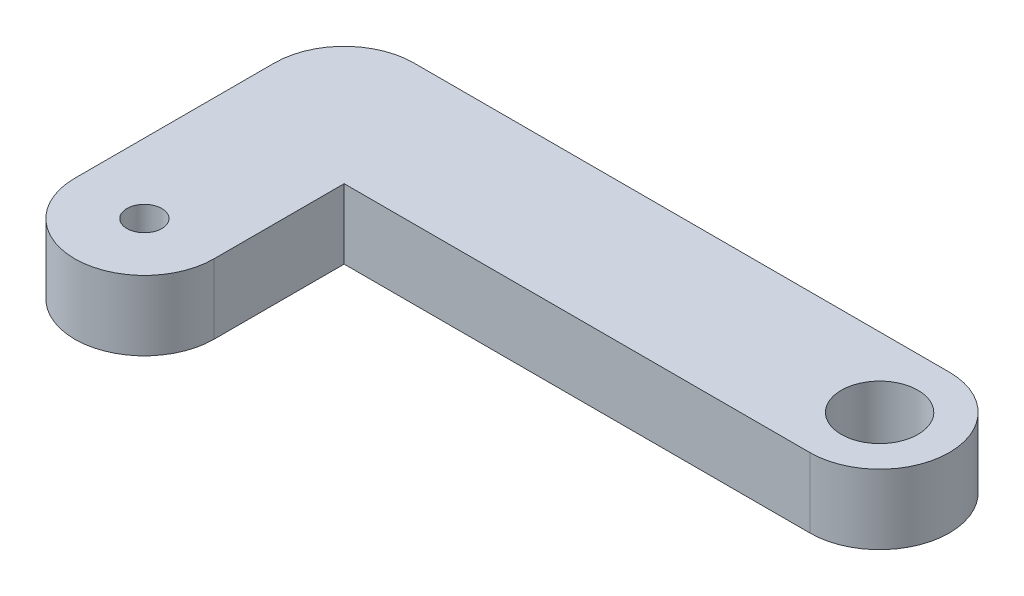
from build123d import *

# Parameters (mm, degrees)
SKETCH_1_R          = 1.65
EXTRUDE_1_DEPTH     = 3
EXTRUDE_2_DEPTH     = 3
CUT_EXTRUDE_1_REACH = 30.673
SKETCH_3_R          = 0.75


with BuildPart() as part:
    # 草图1 → 凸台-拉伸1 (new body)
    with BuildSketch(Plane(origin=(0, 0, 0), x_dir=(1, 0, 0), z_dir=(0, 1, 0))):
        with BuildLine():
            Line((0, 3), (23.05, 3))
            ThreePointArc((23.05, 3), (26.05, 0), (23.05, -3))
            Line((23.05, -3), (0, -3))
            ThreePointArc((0, -3), (-3, 0), (0, 3))
        make_face()
        with Locations(Location((23.05, 0, 0), (0, 0, 270))):
            Circle(SKETCH_1_R, mode=Mode.SUBTRACT)
    extrude(amount=EXTRUDE_1_DEPTH)

    # 草图2 → 凸台-拉伸2 (add)
    with BuildSketch(Plane(origin=(0, 0, 0), x_dir=(1, 0, 0), z_dir=(0, 1, 0))):
        with BuildLine():
            Line((3, 0), (3, -8.6))
            ThreePointArc((3, -8.6), (0, -11.6), (-3, -8.6))
            Line((-3, -8.6), (-3, 0))
            ThreePointArc((-3, 0), (0, 3), (3, 0))
        make_face()
    extrude(amount=EXTRUDE_2_DEPTH)

    # 草图3 → 切除-拉伸1 (cut, up to next)
    with BuildSketch(Plane(origin=(0, 3, 0), x_dir=(1, 0, 0), z_dir=(0, 1, 0)), mode=Mode.PRIVATE) as cut_extrude_1_sk1:
        with Locations(Location((0, -8.6, 0), (0, 0, 270))):
            Circle(SKETCH_3_R)
    cut_extrude_1_tool1 = extrude(cut_extrude_1_sk1.sketch, amount=-CUT_EXTRUDE_1_REACH, mode=Mode.PRIVATE) & part.part
    add(cut_extrude_1_tool1.solids().sort_by_distance((0, 3, 8.6))[0], mode=Mode.SUBTRACT)


solid = part.part
